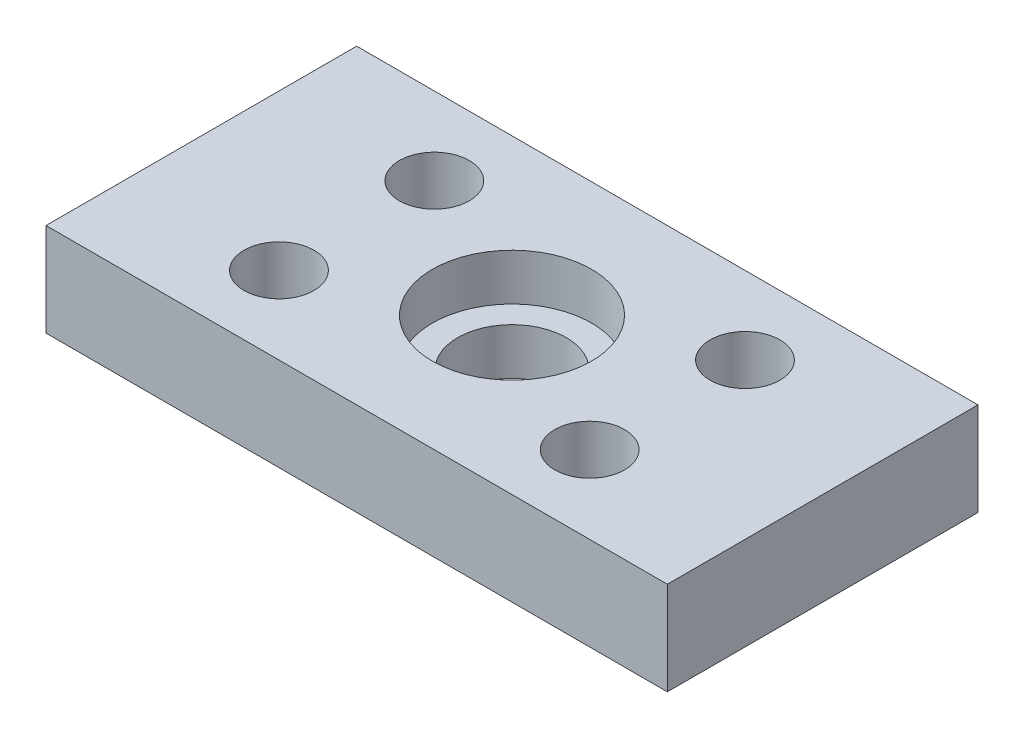
from build123d import *

# Parameters (mm, degrees)
SKETCH_2_W          = 120
SKETCH_2_H          = 20
SKETCH_2_R          = 2.25
EXTRUDE_1_DEPTH     = 6
SKETCH_3_W          = 80
SKETCH_3_H          = 20
CUT_EXTRUDE_1_DEPTH = 62.12282716
SKETCH_4_R          = 5.125
CUT_EXTRUDE_2_DEPTH = 3
SKETCH_5_R          = 3.5
CUT_EXTRUDE_3_DEPTH = 61.901559914


with BuildPart() as part:
    # Эскиз2 → Бобышка-Вытянуть1 (new body)
    with BuildSketch(Plane(origin=(0, 0, 0), x_dir=(1, 0, 0), z_dir=(0, 1, 0))):
        Rectangle(SKETCH_2_W, SKETCH_2_H)
        with Locations(Location((-50, 5, 0), (0, 0, 270))):
            Circle(SKETCH_2_R, mode=Mode.SUBTRACT)
        with Locations(Location((-30, 5, 0), (0, 0, 270))):
            Circle(SKETCH_2_R, mode=Mode.SUBTRACT)
        with Locations(Location((-10, 5, 0), (0, 0, 270))):
            Circle(SKETCH_2_R, mode=Mode.SUBTRACT)
        with Locations(Location((30, 5, 0), (0, 0, 270))):
            Circle(SKETCH_2_R, mode=Mode.SUBTRACT)
        with Locations(Location((-30, -5, 0), (0, 0, 270))):
            Circle(SKETCH_2_R, mode=Mode.SUBTRACT)
        with Locations(Location((10, -5, 0), (0, 0, 270))):
            Circle(SKETCH_2_R, mode=Mode.SUBTRACT)
        with Locations(Location((50, -5, 0), (0, 0, 270))):
            Circle(SKETCH_2_R, mode=Mode.SUBTRACT)
        with Locations(Location((-50, -5, 0), (0, 0, 270))):
            Circle(SKETCH_2_R, mode=Mode.SUBTRACT)
    extrude(amount=EXTRUDE_1_DEPTH)

    # Эскиз3 → Вырез-Вытянуть1 (cut, through all)
    with BuildSketch(Plane(origin=(0, 6, 0), x_dir=(1, 0, 0), z_dir=(0, 1, 0))):
        with Locations((20, 0)):
            Rectangle(SKETCH_3_W, SKETCH_3_H)
    extrude(amount=-CUT_EXTRUDE_1_DEPTH, mode=Mode.SUBTRACT)

    # Эскиз4 → Вырез-Вытянуть2 (cut)
    with BuildSketch(Plane(origin=(0, 6, 0), x_dir=(1, 0, 0), z_dir=(0, 1, 0))):
        with Locations(Location((-40, 0, 0), (0, 0, 270))):
            Circle(SKETCH_4_R)
    extrude(amount=-CUT_EXTRUDE_2_DEPTH, mode=Mode.SUBTRACT)

    # Эскиз5 → Вырез-Вытянуть3 (cut, through all)
    with BuildSketch(Plane(origin=(0, 3, 0), x_dir=(1, 0, 0), z_dir=(0, 1, 0))):
        with Locations(Location((-40, 0, 0), (0, 0, 270))):
            Circle(SKETCH_5_R)
    extrude(amount=-CUT_EXTRUDE_3_DEPTH, mode=Mode.SUBTRACT)


solid = part.part
